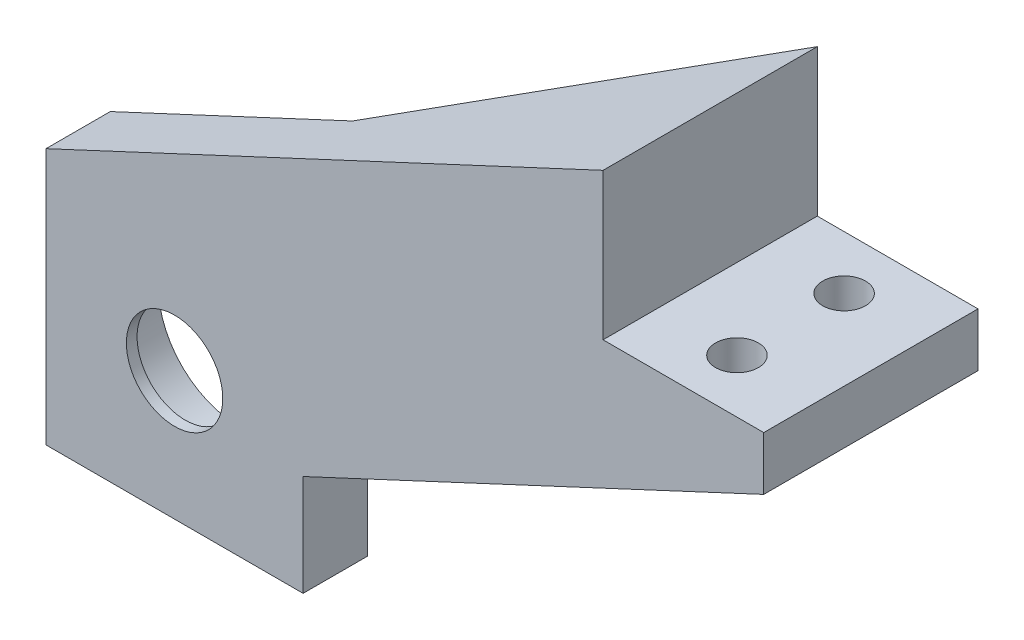
from build123d import *

# Parameters (mm, degrees)
SKETCH1_R           = 10
SKETCH1_R_2         = 7.5
BOSS_EXTRUDE1_DEPTH = 5
BOSS_EXTRUDE2_START = 1
SKETCH1_3_R         = 10
SKETCH1_3_R_2       = 7.5
SKETCH1_3_R_3       = 4.5
BOSS_EXTRUDE2_DEPTH = 1
SKETCH2_R           = 10
BOSS_EXTRUDE3_DEPTH = 6
BOSS_EXTRUDE7_REACH = 67.117
SKETCH3_W           = 15
SKETCH3_H           = 14
SKETCH4_R           = 2
CUT_EXTRUDE4_DEPTH  = 68.647985927
CUT_EXTRUDE5_START  = 3
SKETCH4_3_R         = 2
CUT_EXTRUDE5_DEPTH  = 65.647985927
BOSS_EXTRUDE8_REACH = 69.648


with BuildPart() as part:
    # Sketch1 → Boss-Extrude1 (new body)
    with BuildSketch(Plane.XY):
        Circle(SKETCH1_R)
        Circle(SKETCH1_R_2, mode=Mode.SUBTRACT)
    extrude(amount=-BOSS_EXTRUDE1_DEPTH)

    # Sketch1<3> → Boss-Extrude2 (add)
    # profile 1 of 2: a face of its own
    with BuildSketch(Plane.XY.offset(BOSS_EXTRUDE2_START)):
        Circle(SKETCH1_3_R)
        Circle(SKETCH1_3_R_2, mode=Mode.SUBTRACT)
    # profile 2 of 2: a face of its own
    with BuildSketch(Plane.XY.offset(BOSS_EXTRUDE2_START)):
        Circle(SKETCH1_3_R_2)
        Circle(SKETCH1_3_R_3, mode=Mode.SUBTRACT)
    extrude(amount=-BOSS_EXTRUDE2_DEPTH)

    # Sketch2 → Boss-Extrude3 (add)
    with BuildSketch(Plane.XY.offset(1)):
        Polygon((55, 17.5), (55, 22.5), (40, 22.5), (40, 36.2), (-12, 11.952001776), (-12, -12), (12, -12), (12, -2.551229301), align=None)
        Circle(SKETCH2_R, mode=Mode.SUBTRACT)
    extrude(amount=-BOSS_EXTRUDE3_DEPTH)

    # Boss-Extrude7: up to this plane
    boss_extrude7_end = Plane(origin=(3.120451856, -6.691830601, -87.536295046), z_dir=(-0.422618261740692, 0.9063077870366535, 0))
    # Sketch3 → Boss-Extrude7 (add, up to the surface)
    with BuildSketch(Plane.XZ.offset(-22.5), mode=Mode.PRIVATE) as boss_extrude7_sk1:
        Polygon((40, -5), (40, -19), (10.620255189, -5), align=None)
    boss_extrude7_tool1 = split(extrude(boss_extrude7_sk1.sketch, amount=BOSS_EXTRUDE7_REACH, mode=Mode.PRIVATE), bisect_by=boss_extrude7_end, keep=Keep.BOTH, mode=Mode.PRIVATE)
    add(boss_extrude7_tool1.solids().sort_by_distance((30.206752, 22.5, -9.666667))[0])
    # Sketch3 → Boss-Extrude7 (add, up to the surface)
    with BuildSketch(Plane.XZ.offset(-22.5), mode=Mode.PRIVATE) as boss_extrude7_sk2:
        with Locations((47.5, -12)):
            Rectangle(SKETCH3_W, SKETCH3_H)
    boss_extrude7_tool2 = split(extrude(boss_extrude7_sk2.sketch, amount=BOSS_EXTRUDE7_REACH, mode=Mode.PRIVATE), bisect_by=boss_extrude7_end, keep=Keep.BOTH, mode=Mode.PRIVATE)
    add(boss_extrude7_tool2.solids().sort_by_distance((47.5, 22.5, -12))[0])

    # Sketch4 → Cut-Extrude4 (cut, through all)
    with BuildSketch(Plane.XZ.offset(-22.5)):
        with Locations((47.5, -14)):
            Circle(SKETCH4_R)
        with Locations((47.5, -4)):
            Circle(SKETCH4_R)
    extrude(amount=CUT_EXTRUDE4_DEPTH, mode=Mode.SUBTRACT)

    # Sketch4<3> → Cut-Extrude5 (cut, through all)
    # profile 1 of 2: a face of its own
    with BuildSketch(Plane.XZ.offset(-22.5).offset(CUT_EXTRUDE5_START)):
        Polygon((47.5, -8.041451884), (44, -6.020725942), (44, -1.979274058), (47.5, 0.041451884), (51, -1.979274058), (51, -6.020725942), align=None)
        with Locations(Location((47.5, -4, 0), (0, 0, 270))):
            Circle(SKETCH4_3_R, mode=Mode.SUBTRACT)
    # profile 2 of 2: a face of its own
    with BuildSketch(Plane.XZ.offset(-22.5).offset(CUT_EXTRUDE5_START)):
        Polygon((51, -16.020725942), (51, -11.979274058), (47.5, -9.958548116), (44, -11.979274058), (44, -16.020725942), (47.5, -18.041451884), align=None)
        with Locations(Location((47.5, -14, 0), (0, 0, 270))):
            Circle(SKETCH4_3_R, mode=Mode.SUBTRACT)
    extrude(amount=CUT_EXTRUDE5_DEPTH, mode=Mode.SUBTRACT)

    # Boss-Extrude8: up to this face of the body (flat: up to its plane)
    boss_extrude8_end = Plane(part.part.faces().sort_by_distance((14, 24.076000888, -2))[0])
    # Sketch3<4> → Boss-Extrude8 (add, up to the picked face)
    with BuildSketch(Plane.XZ.offset(-22.5), mode=Mode.PRIVATE) as boss_extrude8_sk1:
        Polygon((40, -5), (40, -19), (10.620255189, -5), align=None)
    boss_extrude8_tool1 = split(extrude(boss_extrude8_sk1.sketch, amount=-BOSS_EXTRUDE8_REACH, mode=Mode.PRIVATE), bisect_by=boss_extrude8_end, keep=Keep.BOTH, mode=Mode.PRIVATE)
    add(boss_extrude8_tool1.solids().sort_by(Axis((30.206752, 22.5, -9.666667), (0, 1, 0)))[0])


solid = part.part
